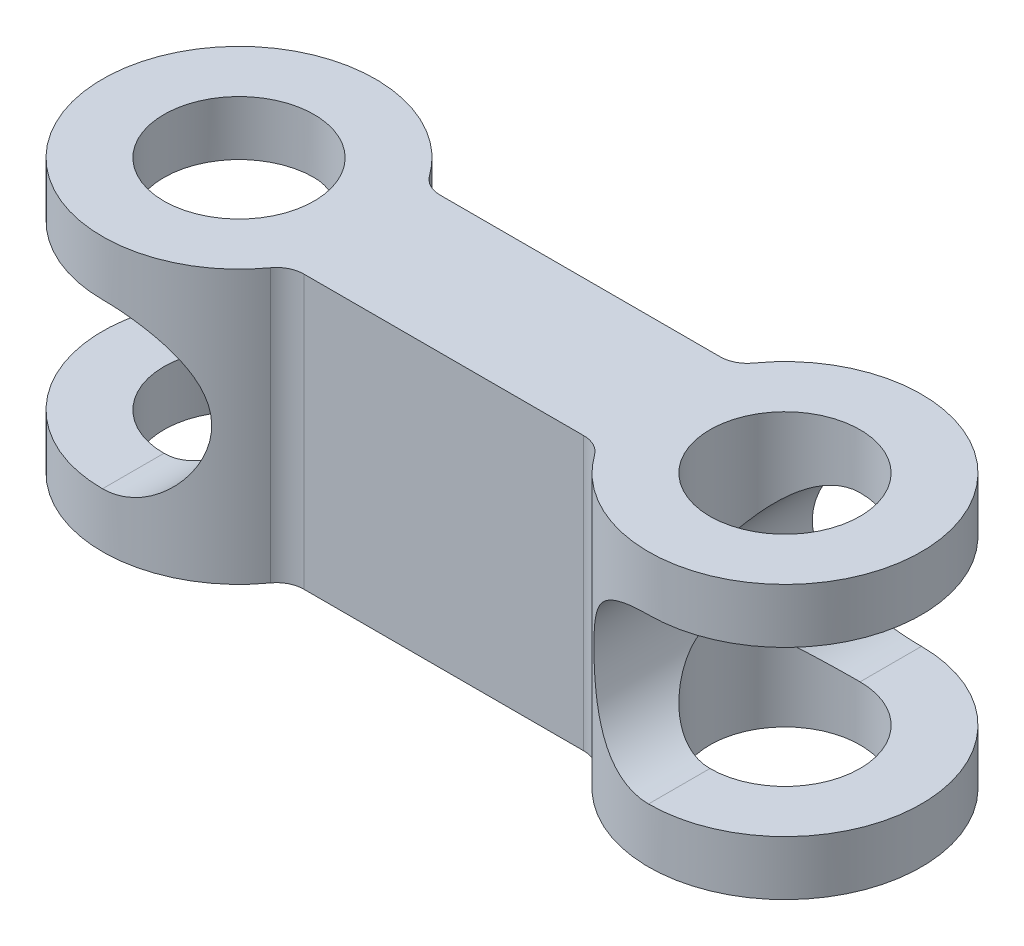
from build123d import *

# Parameters (mm, degrees)
SKETCH1_W            = 10
SKETCH1_H            = 5
BOSS_EXTRUDE1_DEPTH  = 10
SKETCH2_R            = 5
BOSS_EXTRUDE2_DEPTH  = 10
CUT_EXTRUDE1_REACH   = 17
SKETCH3_R            = 2.75
CUT_EXTRUDE2_DEPTH   = 16
FILLET1_R            = 1
FILLET1_OF_MIRROR1_R = 1


with BuildPart() as part:
    # Sketch1 → Boss-Extrude1 (new body)
    with BuildSketch(Plane(origin=(0, 0, 0), x_dir=(1, 0, 0), z_dir=(0, 1, 0))):
        with Locations((5, 0)):
            Rectangle(SKETCH1_W, SKETCH1_H)
    boss_extrude1 = extrude(amount=BOSS_EXTRUDE1_DEPTH)

    # Sketch2 → Boss-Extrude2 (add)
    with BuildSketch(Plane(origin=(0, 0, 0), x_dir=(1, 0, 0), z_dir=(0, 1, 0))):
        Circle(SKETCH2_R)
    boss_extrude2 = extrude(amount=BOSS_EXTRUDE2_DEPTH)

    # Sketch3 → Cut-Extrude1 (cut, up to next)
    with BuildSketch(Plane(origin=(0, 0, 0), x_dir=(1, 0, 0), z_dir=(0, 1, 0)), mode=Mode.PRIVATE) as cut_extrude1_sk1:
        with Locations(Location((0, 0, 0), (0, 0, 270))):
            Circle(SKETCH3_R)
    cut_extrude1_tool1 = extrude(cut_extrude1_sk1.sketch, amount=CUT_EXTRUDE1_REACH, mode=Mode.PRIVATE) & part.part
    cut_extrude1 = cut_extrude1_tool1.solids().sort_by_distance((0, 0, 0))[0]
    add(cut_extrude1, mode=Mode.SUBTRACT)

    # Sketch4 → Cut-Extrude2 (cut, symmetric)
    with BuildSketch(Plane.XY):
        with BuildLine():
            Line((0, 8), (-5, 8))
            Line((-5, 8), (-5, 2))
            Line((-5, 2), (0, 2))
            ThreePointArc((0, 2), (3, 5), (0, 8))
        make_face()
    cut_extrude2 = extrude(amount=CUT_EXTRUDE2_DEPTH, both=True, mode=Mode.SUBTRACT)

    # Fillet1
    fillet1_edges = [part.edges().sort_by_distance(p)[0] for p in [
        (4.330127019, 5, 2.5),
        (4.330127019, 5, -2.5),
    ]]
    fillet(fillet1_edges, radius=FILLET1_R)

    # Mirror1: Boss-Extrude1, Boss-Extrude2, Cut-Extrude1, Cut-Extrude2 across plane
    add(boss_extrude1.mirror(Plane(origin=(10, 10, -2.5), x_dir=(0, 0, 1), z_dir=(-1, 0, 0))))
    add(boss_extrude2.mirror(Plane(origin=(10, 10, -2.5), x_dir=(0, 0, 1), z_dir=(-1, 0, 0))))
    add(cut_extrude1.mirror(Plane(origin=(10, 10, -2.5), x_dir=(0, 0, 1), z_dir=(-1, 0, 0))), mode=Mode.SUBTRACT)
    add(cut_extrude2.mirror(Plane(origin=(10, 10, -2.5), x_dir=(0, 0, 1), z_dir=(-1, 0, 0))), mode=Mode.SUBTRACT)

    # Fillet1 of Mirror1
    fillet1_of_mirror1_edges = [part.edges().sort_by_distance(p)[0] for p in [
        (15.669872981, 5, 2.5),
        (15.669872981, 5, -2.5),
    ]]
    fillet(fillet1_of_mirror1_edges, radius=FILLET1_OF_MIRROR1_R)


solid = part.part
